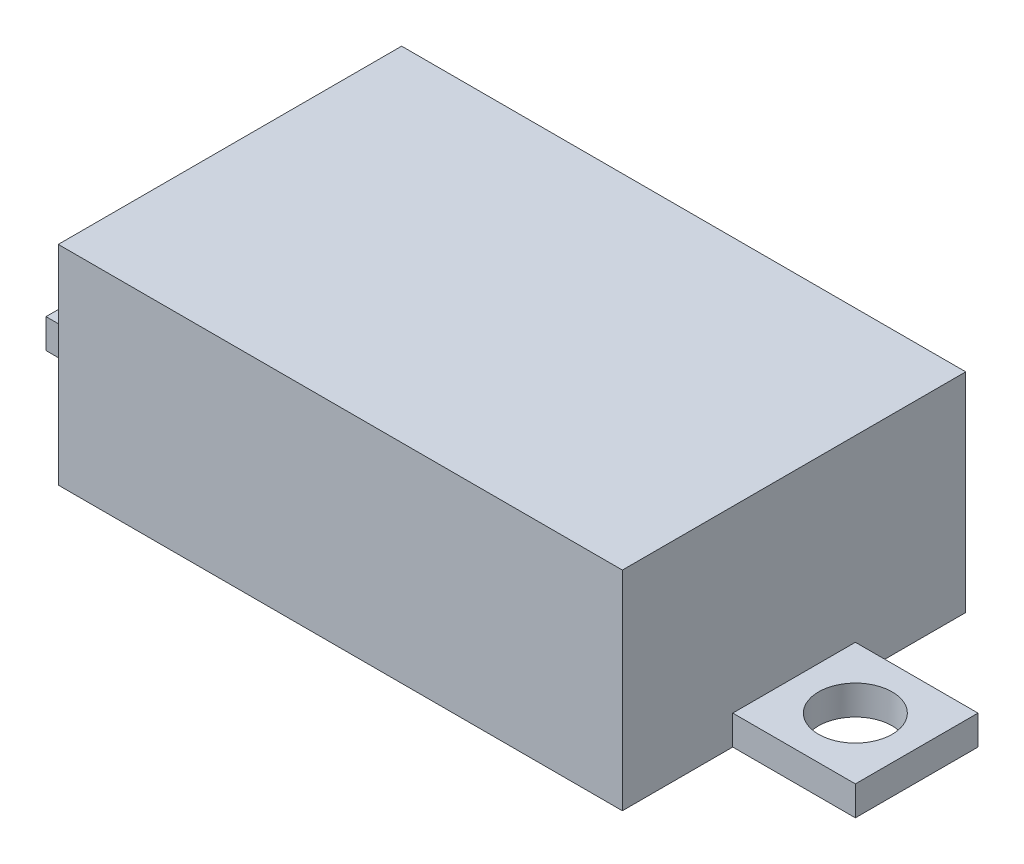
from build123d import *

# Parameters (mm, degrees)
SKETCH1_W           = 23
SKETCH1_H           = 14
BOSS_EXTRUDE1_DEPTH = 8.5
SKETCH2_W           = 33
SKETCH2_H           = 5
BOSS_EXTRUDE2_DEPTH = 1.2
SKETCH3_R           = 1.5
CUT_EXTRUDE1_DEPTH  = 10


with BuildPart() as part:
    # Sketch1 → Boss-Extrude1 (new body)
    with BuildSketch(Plane(origin=(0, 0, 0), x_dir=(1, 0, 0), z_dir=(0, 1, 0))):
        with Locations((11.5, 7)):
            Rectangle(SKETCH1_W, SKETCH1_H)
    extrude(amount=BOSS_EXTRUDE1_DEPTH)

    # Sketch2 → Boss-Extrude2 (add)
    with BuildSketch(Plane.XZ):
        with Locations((11.5, -7)):
            Rectangle(SKETCH2_W, SKETCH2_H)
    extrude(amount=-BOSS_EXTRUDE2_DEPTH)

    # Sketch3 → Cut-Extrude1 (cut)
    with BuildSketch(Plane(origin=(0, 1.2, 0), x_dir=(1, 0, 0), z_dir=(0, 1, 0))):
        with Locations(Location((-2.5, 7, 0), (0, 0, 270))):
            Circle(SKETCH3_R)
        with Locations(Location((25.5, 7, 0), (0, 0, 270))):
            Circle(SKETCH3_R)
    extrude(amount=-CUT_EXTRUDE1_DEPTH, mode=Mode.SUBTRACT)


solid = part.part
